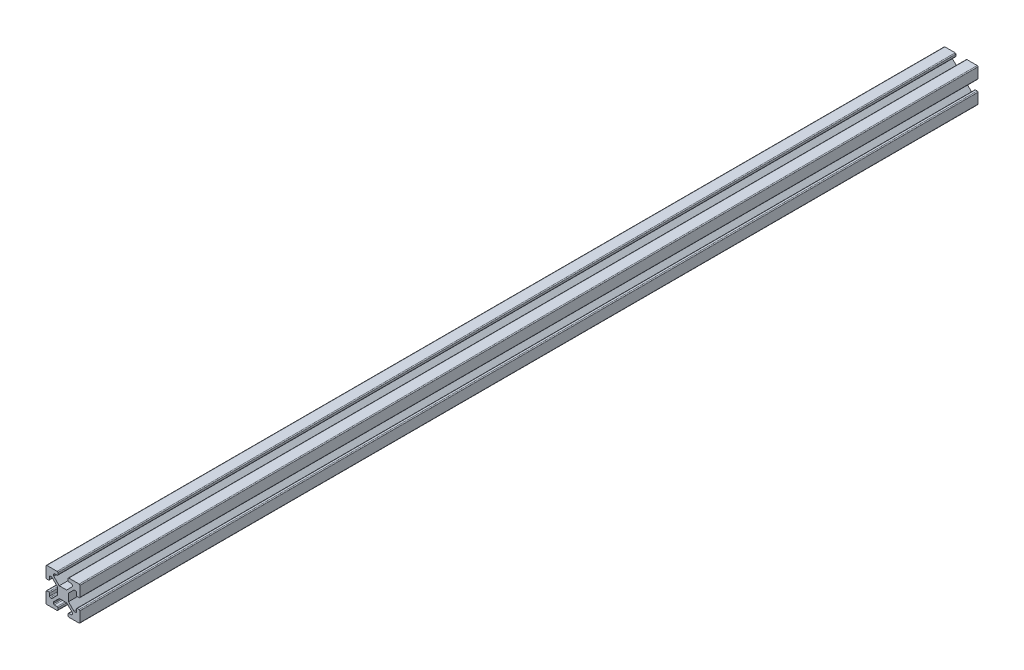
from build123d import *

# Parameters (mm, degrees)
EXTRUDE_1_DEPTH = 530


with BuildPart() as part:
    # 草图1 → 凸台-拉伸1 (new body)
    with BuildSketch(Plane.XY):
        with BuildLine():
            Line((6.5, 0), (0.5, 0))
            ThreePointArc((0.5, 0), (0.146446609, -0.146446609), (0, -0.5))
            Line((0, -0.5), (0, -6.5))
            ThreePointArc((0, -6.5), (0.146446609, -6.853553391), (0.5, -7))
            Line((0.5, -7), (1.5, -7))
            ThreePointArc((1.5, -7), (1.853553391, -6.853553391), (2, -6.5))
            Line((2, -6.5), (2, -5))
            ThreePointArc((2, -5), (2.146446609, -4.646446609), (2.5, -4.5))
            Line((2.5, -4.5), (3.220918534, -4.5))
            ThreePointArc((3.220918534, -4.5), (3.412260251, -4.538060234), (3.574471925, -4.646446609))
            Line((3.574471925, -4.646446609), (6.741642787, -7.813617472))
            Line((6.741642787, -7.813617472), (6.741642787, -12.186382528))
            Line((6.741642787, -12.186382528), (3.574471925, -15.353553391))
            ThreePointArc((3.574471925, -15.353553391), (3.412260251, -15.461939766), (3.220918534, -15.5))
            Line((3.220918534, -15.5), (2.5, -15.5))
            ThreePointArc((2.5, -15.5), (2.146446609, -15.353553391), (2, -15))
            Line((2, -15), (2, -13.5))
            ThreePointArc((2, -13.5), (1.853553391, -13.146446609), (1.5, -13))
            Line((1.5, -13), (0.5, -13))
            ThreePointArc((0.5, -13), (0.146446609, -13.146446609), (0, -13.5))
            Line((0, -13.5), (0, -19.5))
            ThreePointArc((0, -19.5), (0.146446609, -19.853553391), (0.5, -20))
            Line((0.5, -20), (6.5, -20))
            ThreePointArc((6.5, -20), (6.853553391, -19.853553391), (7, -19.5))
            Line((7, -19.5), (7, -18.5))
            ThreePointArc((7, -18.5), (6.853553391, -18.146446609), (6.5, -18))
            Line((6.5, -18), (5, -18))
            ThreePointArc((5, -18), (4.646446609, -17.853553391), (4.5, -17.5))
            Line((4.5, -17.5), (4.5, -16.779081466))
            ThreePointArc((4.5, -16.779081466), (4.538060234, -16.587739749), (4.646446609, -16.425528075))
            Line((4.646446609, -16.425528075), (7.667170862, -13.404803822))
            ThreePointArc((7.667170862, -13.404803822), (7.829382537, -13.296417446), (8.020724253, -13.258357213))
            Line((8.020724253, -13.258357213), (11.979275747, -13.258357213))
            ThreePointArc((11.979275747, -13.258357213), (12.170617463, -13.296417446), (12.332829138, -13.404803822))
            Line((12.332829138, -13.404803822), (15.353553391, -16.425528075))
            ThreePointArc((15.353553391, -16.425528075), (15.461939766, -16.587739749), (15.5, -16.779081466))
            Line((15.5, -16.779081466), (15.5, -17.5))
            ThreePointArc((15.5, -17.5), (15.353553391, -17.853553391), (15, -18))
            Line((15, -18), (13.5, -18))
            ThreePointArc((13.5, -18), (13.146446609, -18.146446609), (13, -18.5))
            Line((13, -18.5), (13, -19.5))
            ThreePointArc((13, -19.5), (13.146446609, -19.853553391), (13.5, -20))
            Line((13.5, -20), (19.5, -20))
            ThreePointArc((19.5, -20), (19.853553391, -19.853553391), (20, -19.5))
            Line((20, -19.5), (20, -13.5))
            ThreePointArc((20, -13.5), (19.853553391, -13.146446609), (19.5, -13))
            Line((19.5, -13), (18.5, -13))
            ThreePointArc((18.5, -13), (18.146446609, -13.146446609), (18, -13.5))
            Line((18, -13.5), (18, -15))
            ThreePointArc((18, -15), (17.853553391, -15.353553391), (17.5, -15.5))
            Line((17.5, -15.5), (16.779081466, -15.5))
            ThreePointArc((16.779081466, -15.5), (16.587739749, -15.461939766), (16.425528075, -15.353553391))
            Line((16.425528075, -15.353553391), (13.258357213, -12.186382528))
            Line((13.258357213, -12.186382528), (13.258357213, -7.813617472))
            Line((13.258357213, -7.813617472), (16.425528075, -4.646446609))
            ThreePointArc((16.425528075, -4.646446609), (16.587739749, -4.538060234), (16.779081466, -4.5))
            Line((16.779081466, -4.5), (17.5, -4.5))
            ThreePointArc((17.5, -4.5), (17.853553391, -4.646446609), (18, -5))
            Line((18, -5), (18, -6.5))
            ThreePointArc((18, -6.5), (18.146446609, -6.853553391), (18.5, -7))
            Line((18.5, -7), (19.5, -7))
            ThreePointArc((19.5, -7), (19.853553391, -6.853553391), (20, -6.5))
            Line((20, -6.5), (20, -0.5))
            ThreePointArc((20, -0.5), (19.853553391, -0.146446609), (19.5, 0))
            Line((19.5, 0), (13.5, 0))
            ThreePointArc((13.5, 0), (13.146446609, -0.146446609), (13, -0.5))
            Line((13, -0.5), (13, -1.5))
            ThreePointArc((13, -1.5), (13.146446609, -1.853553391), (13.5, -2))
            Line((13.5, -2), (15, -2))
            ThreePointArc((15, -2), (15.353553391, -2.146446609), (15.5, -2.5))
            Line((15.5, -2.5), (15.5, -3.220918534))
            ThreePointArc((15.5, -3.220918534), (15.461939766, -3.412260251), (15.353553391, -3.574471925))
            Line((15.353553391, -3.574471925), (12.186382528, -6.741642787))
            Line((12.186382528, -6.741642787), (7.813617472, -6.741642787))
            Line((7.813617472, -6.741642787), (4.646446609, -3.574471925))
            ThreePointArc((4.646446609, -3.574471925), (4.538060234, -3.412260251), (4.5, -3.220918534))
            Line((4.5, -3.220918534), (4.5, -2.5))
            ThreePointArc((4.5, -2.5), (4.646446609, -2.146446609), (5, -2))
            Line((5, -2), (6.5, -2))
            ThreePointArc((6.5, -2), (6.853553391, -1.853553391), (7, -1.5))
            Line((7, -1.5), (7, -0.5))
            ThreePointArc((7, -0.5), (6.853553391, -0.146446609), (6.5, 0))
        make_face()
    extrude(amount=EXTRUDE_1_DEPTH)


solid = part.part
